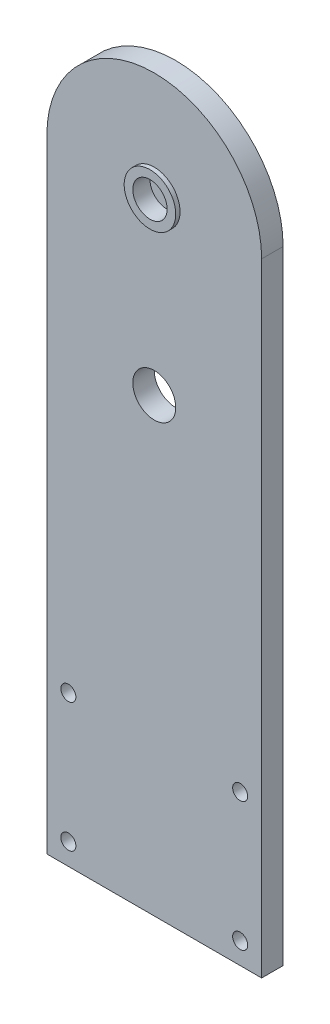
from build123d import *

# Parameters (mm, degrees)
BOSS_EXTRUDE1_DEPTH = 5
SKETCH2_R           = 4
CUT_EXTRUDE1_DEPTH  = 3
BOSS_EXTRUDE2_START = 1
SKETCH3_R           = 6
SKETCH3_R_2         = 4
BOSS_EXTRUDE2_DEPTH = 1
SKETCH4_R           = 1.75
CUT_EXTRUDE2_DEPTH  = 148.224318643
SKETCH5_R           = 5
CUT_EXTRUDE3_DEPTH  = 148.224318643


with BuildPart() as part:
    # Sketch1 → Boss-Extrude1 (new body)
    with BuildSketch(Plane.XY):
        with BuildLine():
            Line((-25, -145), (25, -145))
            Line((25, -145), (25, 0))
            ThreePointArc((25, 0), (0, 25), (-25, 0))
            Line((-25, 0), (-25, -145))
        make_face()
    extrude(amount=BOSS_EXTRUDE1_DEPTH)

    # Sketch2 → Cut-Extrude1 (cut)
    with BuildSketch(Plane.XY.offset(5)):
        Circle(SKETCH2_R)
    extrude(amount=-CUT_EXTRUDE1_DEPTH, mode=Mode.SUBTRACT)

    # Sketch3 → Boss-Extrude2 (add)
    with BuildSketch(Plane.XY.offset(5).offset(BOSS_EXTRUDE2_START)):
        Circle(SKETCH3_R)
        Circle(SKETCH3_R_2, mode=Mode.SUBTRACT)
    extrude(amount=-BOSS_EXTRUDE2_DEPTH)

    # Sketch4 → Cut-Extrude2 (cut, through all)
    with BuildSketch(Plane.XY.offset(5)):
        with Locations((-20, -140)):
            Circle(SKETCH4_R)
        with Locations((-20, -110)):
            Circle(SKETCH4_R)
        with Locations(Location((20, -110, 0), (0, 0, 180))):
            Circle(SKETCH4_R)
        with Locations(Location((20, -140, 0), (0, 0, 180))):
            Circle(SKETCH4_R)
    extrude(amount=-CUT_EXTRUDE2_DEPTH, mode=Mode.SUBTRACT)

    # Sketch5 → Cut-Extrude3 (cut, through all)
    with BuildSketch(Plane.XY.offset(5)):
        with Locations((0, -40)):
            Circle(SKETCH5_R)
    extrude(amount=-CUT_EXTRUDE3_DEPTH, mode=Mode.SUBTRACT)


solid = part.part
